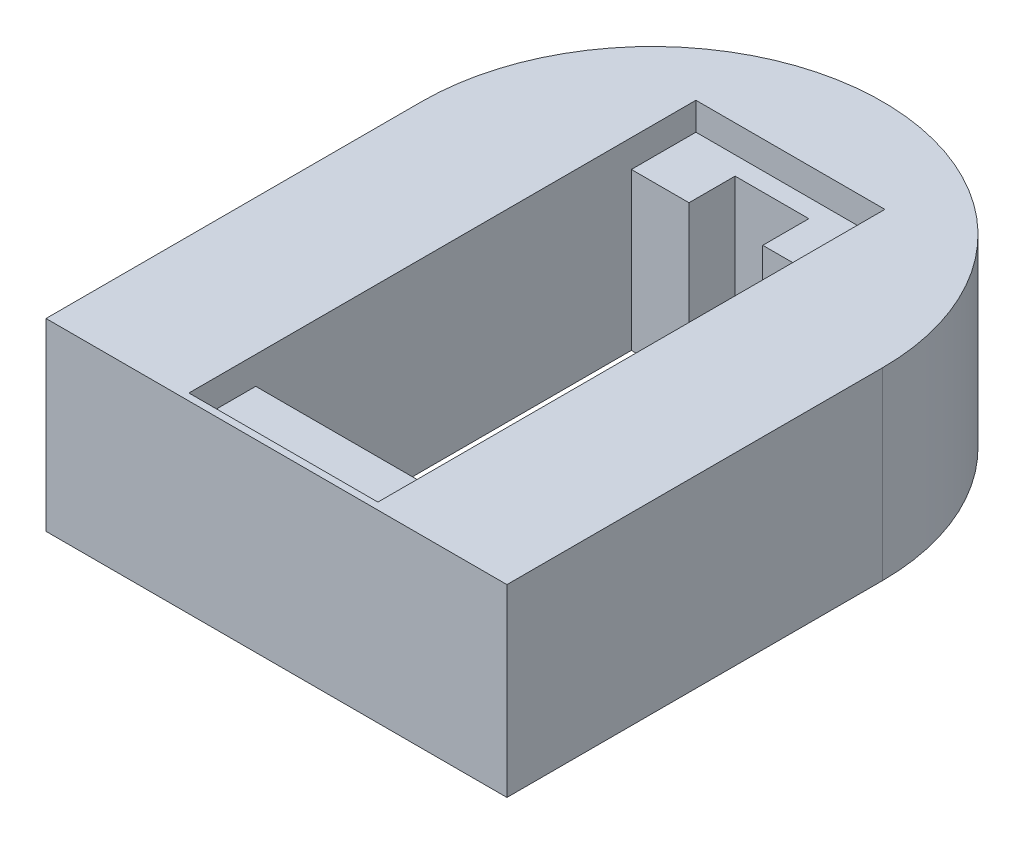
from build123d import *

# Parameters (mm, degrees)
BOSS_EXTRUDE1_DEPTH = 20
CUT_EXTRUDE1_DEPTH  = 20
SKETCH3_W           = 20.5
SKETCH3_H           = 7
SKETCH3_H_2         = 7.25
CUT_EXTRUDE2_DEPTH  = 3


with BuildPart() as part:
    # Sketch1 → Boss-Extrude1 (new body)
    with BuildSketch(Plane(origin=(0, 0, 0), x_dir=(1, 0, 0), z_dir=(0, 1, 0))):
        with BuildLine():
            Line((0, 0), (50, 0))
            Line((50, 0), (50, 40.75))
            ThreePointArc((50, 40.75), (25, 65.75), (0, 40.75))
            Line((0, 40.75), (0, 0))
        make_face()
    extrude(amount=BOSS_EXTRUDE1_DEPTH)

    # Sketch2 → Cut-Extrude1 (cut)
    with BuildSketch(Plane(origin=(0, 20, 0), x_dir=(1, 0, 0), z_dir=(0, 1, 0))):
        Polygon((14.75, 8), (35.25, 8), (35.25, 48.75), (29, 48.75), (29, 53.75), (21, 53.75), (21, 48.75), (14.75, 48.75), align=None)
    extrude(amount=-CUT_EXTRUDE1_DEPTH, mode=Mode.SUBTRACT)

    # Sketch3 → Cut-Extrude2 (cut)
    with BuildSketch(Plane(origin=(0, 20, 0), x_dir=(1, 0, 0), z_dir=(0, 1, 0))):
        with Locations((25, 52.25)):
            Rectangle(SKETCH3_W, SKETCH3_H)
        with Locations((25, 4.375)):
            Rectangle(SKETCH3_W, SKETCH3_H_2)
    extrude(amount=-CUT_EXTRUDE2_DEPTH, mode=Mode.SUBTRACT)


solid = part.part
